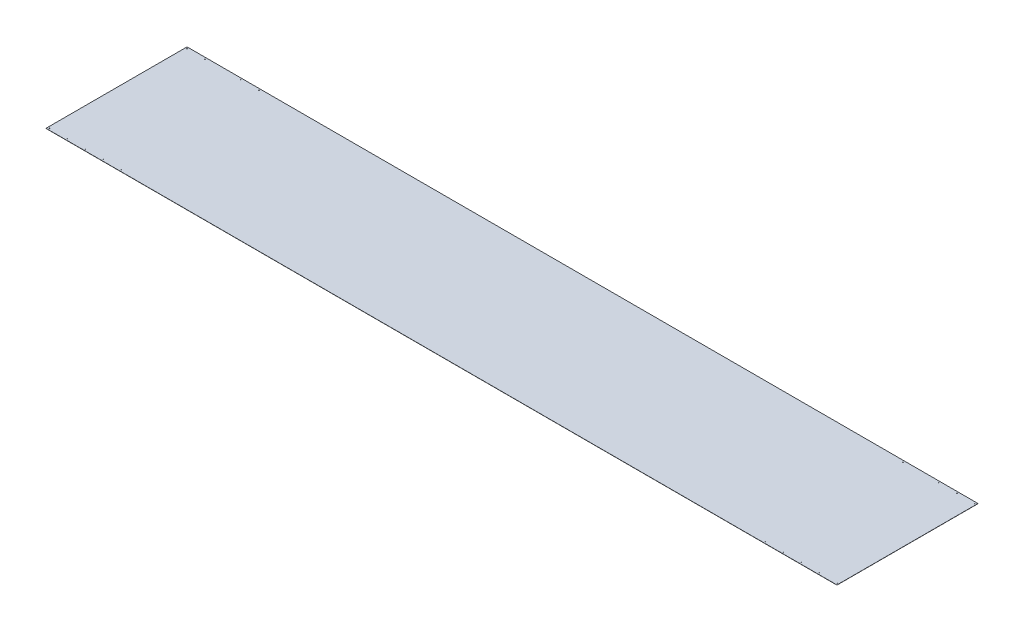
from build123d import *

# Parameters (mm, degrees)
SKETCH1_W           = 9358.5
SKETCH1_H           = 1669
BOSS_EXTRUDE1_DEPTH = 2
SKETCH3_R           = 3.25
CUT_EXTRUDE1_DEPTH  = 10


with BuildPart() as part:
    # Sketch1 → Boss-Extrude1 (new body)
    with BuildSketch(Plane(origin=(0, 0, 0), x_dir=(1, 0, 0), z_dir=(0, 1, 0))):
        Rectangle(SKETCH1_W, SKETCH1_H)
    extrude(amount=BOSS_EXTRUDE1_DEPTH)

    # Sketch3 → Cut-Extrude1 (cut)
    with BuildSketch(Plane(origin=(0, 2, 0), x_dir=(1, 0, 0), z_dir=(0, 1, 0))):
        with Locations(Location((-4659.25, 814.5, 0), (0, 0, 270))):
            Circle(SKETCH3_R)
        with Locations(Location((-4659.25, -814.5, 0), (0, 0, 270))):
            Circle(SKETCH3_R)
        with Locations(Location((-4446.75, 814.5, 0), (0, 0, 270))):
            Circle(SKETCH3_R)
        with Locations(Location((-4446.75, -814.5, 0), (0, 0, 270))):
            Circle(SKETCH3_R)
        with Locations(Location((-4234.25, 814.5, 0), (0, 0, 270))):
            Circle(SKETCH3_R)
        with Locations(Location((-4234.25, -814.5, 0), (0, 0, 270))):
            Circle(SKETCH3_R)
        with Locations(Location((-4021.75, 814.5, 0), (0, 0, 270))):
            Circle(SKETCH3_R)
        with Locations(Location((-4021.75, -814.5, 0), (0, 0, 270))):
            Circle(SKETCH3_R)
        with Locations(Location((-3809.25, 814.5, 0), (0, 0, 270))):
            Circle(SKETCH3_R)
        with Locations(Location((-3809.25, -814.5, 0), (0, 0, 270))):
            Circle(SKETCH3_R)
        with Locations(Location((4662.25, 814.5, 0), (0, 0, 270))):
            Circle(SKETCH3_R)
        with Locations(Location((4662.25, -814.5, 0), (0, 0, 270))):
            Circle(SKETCH3_R)
        with Locations(Location((4449.75, 814.5, 0), (0, 0, 270))):
            Circle(SKETCH3_R)
        with Locations(Location((4449.75, -814.5, 0), (0, 0, 270))):
            Circle(SKETCH3_R)
        with Locations(Location((4237.25, 814.5, 0), (0, 0, 270))):
            Circle(SKETCH3_R)
        with Locations(Location((4237.25, -814.5, 0), (0, 0, 270))):
            Circle(SKETCH3_R)
        with Locations(Location((4024.75, 814.5, 0), (0, 0, 270))):
            Circle(SKETCH3_R)
        with Locations(Location((4024.75, -814.5, 0), (0, 0, 270))):
            Circle(SKETCH3_R)
        with Locations(Location((3812.25, 814.5, 0), (0, 0, 270))):
            Circle(SKETCH3_R)
        with Locations(Location((3812.25, -814.5, 0), (0, 0, 270))):
            Circle(SKETCH3_R)
    extrude(amount=-CUT_EXTRUDE1_DEPTH, mode=Mode.SUBTRACT)


solid = part.part
